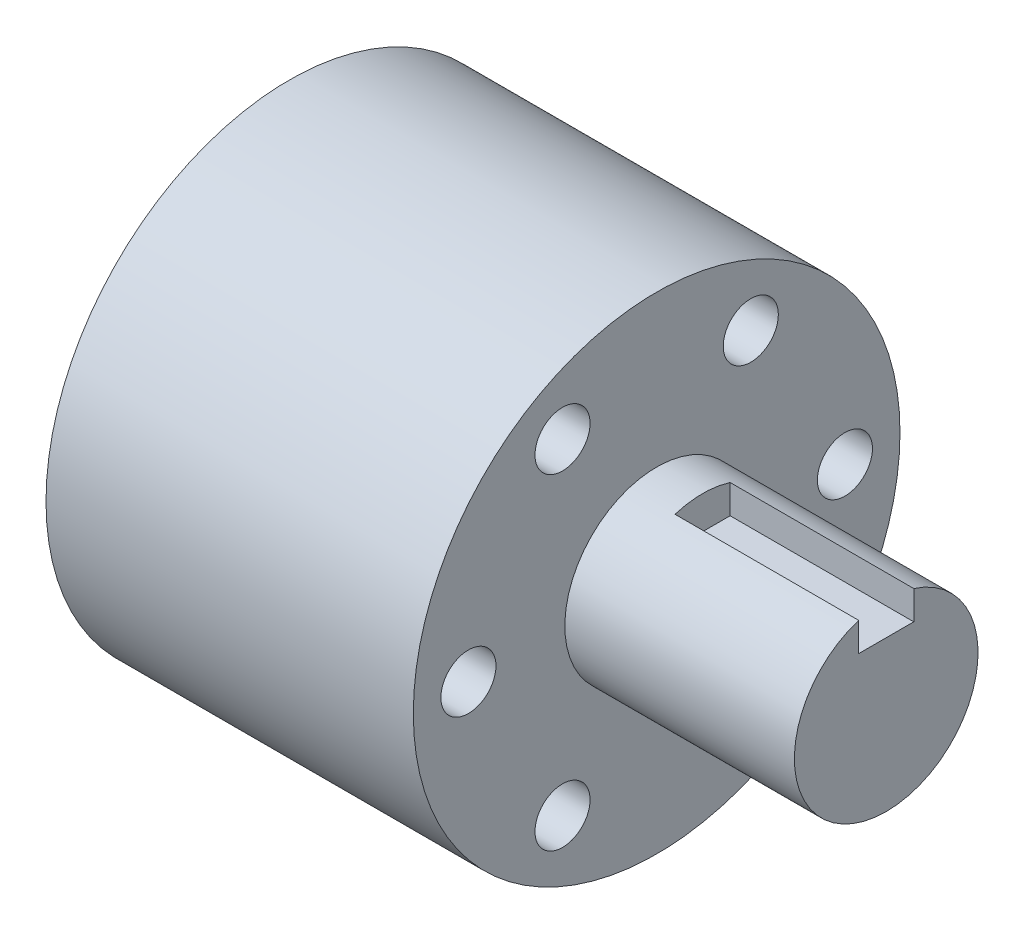
from build123d import *

# Parameters (mm, degrees)
SKETCH_1_R          = 13.25
EXTRUDE_1_DEPTH     = 20
SKETCH_2_R          = 1.5
CUT_EXTRUDE_1_DEPTH = 5
SKETCH_3_R          = 5
EXTRUDE_2_DEPTH     = 12.5
CUT_EXTRUDE_START   = -10
CUT_EXTRUDE_2_DEPTH = 10


with BuildPart() as part:
    # 草图1 → 凸台-拉伸1 (new body)
    with BuildSketch(Plane(origin=(0, 0, 0), x_dir=(0, 0, -1), z_dir=(1, 0, 0))):
        Circle(SKETCH_1_R)
    extrude(amount=EXTRUDE_1_DEPTH)

    # 草图2 → 切除-拉伸1 (cut)
    with BuildSketch(Plane(origin=(20, 0, 0), x_dir=(0, 0, -1), z_dir=(1, 0, 0))):
        with Locations((10.25, 0)):
            Circle(SKETCH_2_R)
        with Locations((5.125, -8.876760389)):
            Circle(SKETCH_2_R)
        with Locations((-5.125, -8.876760389)):
            Circle(SKETCH_2_R)
        with Locations((-10.25, 0)):
            Circle(SKETCH_2_R)
        with Locations((-5.125, 8.876760389)):
            Circle(SKETCH_2_R)
        with Locations((5.125, 8.876760389)):
            Circle(SKETCH_2_R)
    extrude(amount=-CUT_EXTRUDE_1_DEPTH, mode=Mode.SUBTRACT)

    # 草图3 → 凸台-拉伸2 (add)
    with BuildSketch(Plane(origin=(20, 0, 0), x_dir=(0, 0, -1), z_dir=(1, 0, 0))):
        Circle(SKETCH_3_R)
    extrude(amount=EXTRUDE_2_DEPTH)

    # 草图4 → 切除-拉伸2 (cut)
    with BuildSketch(Plane(origin=(32.5, 0, 0), x_dir=(0, 0, -1), z_dir=(1, 0, 0)).offset(CUT_EXTRUDE_START)):
        with BuildLine():
            Line((-1.5, 3.2), (1.5, 3.2))
            Line((1.5, 3.2), (1.5, 4.769696007))
            ThreePointArc((1.5, 4.769696007), (0, 5), (-1.5, 4.769696007))
            Line((-1.5, 4.769696007), (-1.5, 3.2))
        make_face()
    extrude(amount=CUT_EXTRUDE_2_DEPTH, mode=Mode.SUBTRACT)


solid = part.part
